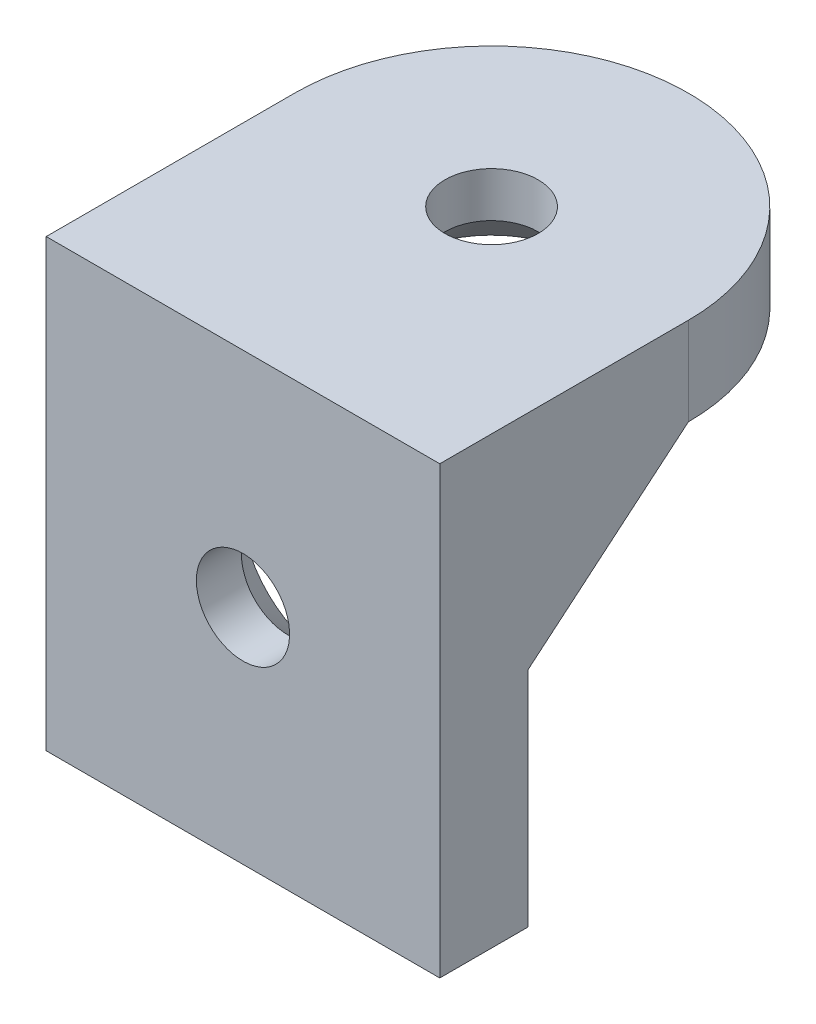
from build123d import *

# Parameters (mm, degrees)
SKETCH_1_W      = 38
SKETCH_1_H      = 43
EXTRUDE_1_DEPTH = 8.5
EXTRUDE_2_DEPTH = 8.5
EXTRUDE_3_DEPTH = 3.8


with BuildPart() as part:
    # 草图1 → 凸台-拉伸1 (new body)
    with BuildSketch(Plane.XY):
        Rectangle(SKETCH_1_W, SKETCH_1_H)
    extrude(amount=EXTRUDE_1_DEPTH)

    # 草图2 → 凸台-拉伸2 (add)
    with BuildSketch(Plane(origin=(0, 21.5, 0), x_dir=(1, 0, 0), z_dir=(0, 1, 0))):
        with BuildLine():
            Line((-19, -8.5), (19, -8.5))
            Line((19, -8.5), (19, 15.5))
            ThreePointArc((19, 15.5), (0, 34.5), (-19, 15.5))
            Line((-19, 15.5), (-19, -8.5))
        make_face()
    extrude(amount=-EXTRUDE_2_DEPTH)

    # 草图5 → 凸台-拉伸3 (add)
    with BuildSketch(Plane(origin=(19, 0, 0), x_dir=(0, 0, -1), z_dir=(1, 0, 0))):
        Polygon((15.5, 13), (0, 13), (0, 0), align=None)
    extrude_3 = extrude(amount=-EXTRUDE_3_DEPTH)

    # 镜向1: 凸台-拉伸3 across plane
    add(extrude_3.mirror(Plane(origin=(0, 0, 0), x_dir=(0, 0, 1), z_dir=(1, 0, 0))))

    # 草图6 → M8 平锥沉头螺钉的锥形沉头孔1 (revolve, cut)
    with BuildSketch(Plane.YZ):
        Polygon((0, 0), (0, 8.5), (4.5, 8.5), (4.5, 4.15), (8.65, 0), align=None)
    revolve(axis=Axis((0, 0, -6.35), (0, 0, 1)), mode=Mode.SUBTRACT)

    # 草图8 → M8 平锥沉头螺钉的锥形沉头孔2 (revolve, cut)
    with BuildSketch(Plane(origin=(0, 13, -15.5), x_dir=(0, 0, -1), z_dir=(1, 0, 0))):
        Polygon((0, 0), (0, 8.5), (4.5, 8.5), (4.5, 4.15), (8.65, 0), align=None)
    revolve(axis=Axis((0, 6.65, -15.5), (0, 1, 0)), mode=Mode.SUBTRACT)


solid = part.part
